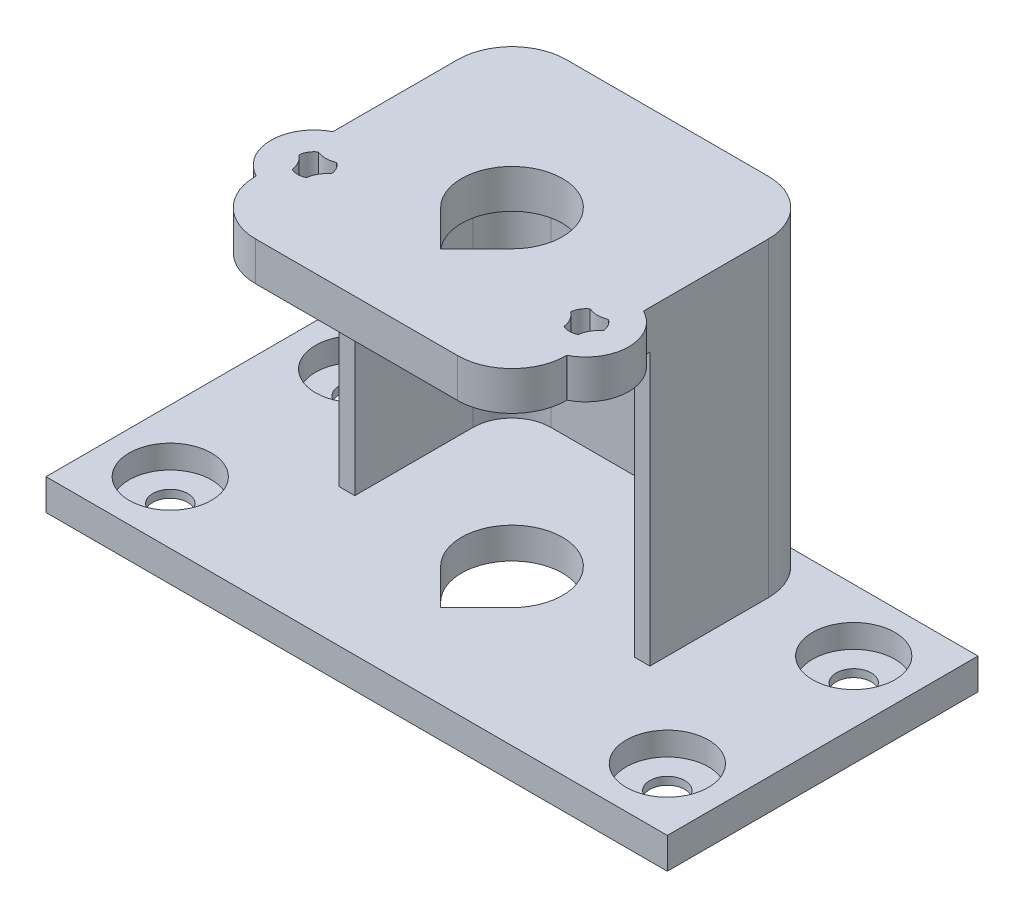
from build123d import *

# Parameters (mm, degrees)
BOSS_EXTRU_1_DEPTH                                 = 5
ESQUISSE7_W                                        = 36
ESQUISSE7_H                                        = 2
BOSS_EXTRU_2_DEPTH                                 = 35
BOSS_EXTRU_4_DEPTH                                 = 4
ESQUISSE1_3_R                                      = 6.5
ENL_V_MAT_EXTRU_2_DEPTH                            = 63.737548565
CHAMBRAGE_POUR_VIS_T_TE_HEXAGONALE_M41_D           = 4.5
CHAMBRAGE_POUR_VIS_T_TE_HEXAGONALE_M41_DEPTH       = 4
CHAMBRAGE_POUR_VIS_T_TE_HEXAGONALE_M41_CBORE_D     = 10.59
CHAMBRAGE_POUR_VIS_T_TE_HEXAGONALE_M41_CBORE_DEPTH = 3
CHAMBRAGE_POUR_VIS_T_TE_HEXAGONALE_M41_TIP         = 1.351936393
CONG_1_R                                           = 5
CONG_2_R                                           = 7


with BuildPart() as part:
    # Esquisse1 → Boss.-Extru.1 (new body)
    with BuildSketch(Plane(origin=(0, 0, 0), x_dir=(1, 0, 0), z_dir=(0, 1, 0))):
        with BuildLine():
            Line((20, 20), (-20, 20))
            Line((-20, 20), (-20, -3.067363788))
            ThreePointArc((-20, -3.067363788), (-23.03, -8), (-20, -12.932636212))
            Line((-20, -12.932636212), (-20, -20))
            Line((-20, -20), (20, -20))
            Line((20, -20), (20, -12.932636212))
            ThreePointArc((20, -12.932636212), (23.03, -8), (20, -3.067363788))
            Line((20, -3.067363788), (20, 20))
        make_face()
        with BuildLine():
            ThreePointArc((-16.580993336, -9.888233765), (-17.5, -10.1), (-18.419006664, -9.888233765))
            ThreePointArc((-18.419006664, -9.888233765), (-18.799038106, -8.75), (-19.594761741, -7.851766235))
            ThreePointArc((-19.594761741, -7.851766235), (-19.318653348, -6.95), (-18.675755077, -6.26))
            ThreePointArc((-18.675755077, -6.26), (-17.5, -6.5), (-16.324244923, -6.26))
            ThreePointArc((-16.324244923, -6.26), (-15.681346652, -6.95), (-15.405238259, -7.851766235))
            ThreePointArc((-15.405238259, -7.851766235), (-16.200961894, -8.75), (-16.580993336, -9.888233765))
        make_face(mode=Mode.SUBTRACT)
        with BuildLine():
            Line((4.596194078, -4.596194078), (0, -9.192388155))
            Line((0, -9.192388155), (-4.596194078, -4.596194078))
            ThreePointArc((-4.596194078, -4.596194078), (0, 6.5), (4.596194078, -4.596194078))
        make_face(mode=Mode.SUBTRACT)
        with BuildLine():
            ThreePointArc((18.419006664, -9.888233765), (17.5, -10.1), (16.580993336, -9.888233765))
            ThreePointArc((16.580993336, -9.888233765), (16.200961894, -8.75), (15.405238259, -7.851766235))
            ThreePointArc((15.405238259, -7.851766235), (15.681346652, -6.95), (16.324244923, -6.26))
            ThreePointArc((16.324244923, -6.26), (17.5, -6.5), (18.675755077, -6.26))
            ThreePointArc((18.675755077, -6.26), (19.318653348, -6.95), (19.594761741, -7.851766235))
            ThreePointArc((19.594761741, -7.851766235), (18.799038106, -8.75), (18.419006664, -9.888233765))
        make_face(mode=Mode.SUBTRACT)
    extrude(amount=-BOSS_EXTRU_1_DEPTH)

    # Esquisse7 → Boss.-Extru.2 (add)
    with BuildSketch(Plane.XZ.offset(5)):
        Polygon((-20, 2.243441463), (-20, -20), (-18, -20), (-18, -18), (-18, 2.243441463), align=None)
        with Locations((0, -19)):
            Rectangle(ESQUISSE7_W, ESQUISSE7_H)
        Polygon((18, -18), (18, -20), (20, -20), (20, 2.243441463), (18, 2.243441463), align=None)
    extrude(amount=BOSS_EXTRU_2_DEPTH)

    # Esquisse9 → Boss.-Extru.4 (add)
    with BuildSketch(Plane.XZ.offset(40)):
        Polygon((-20, 2.243441463), (-20, 20), (-40, 20), (-40, -20), (-20, -20), align=None)
        Polygon((40, 20), (20, 20), (20, 2.243441463), (20, -20), (40, -20), align=None)
        Polygon((0, -18), (0, 20), (-20, 20), (-20, 2.243441463), (-18, 2.243441463), (-18, -18), align=None)
        Polygon((0, -20), (0, -18), (-18, -18), (-18, 2.243441463), (-20, 2.243441463), (-20, -20), align=None)
        Polygon((18, -18), (0, -18), (0, -20), (20, -20), (20, 2.243441463), (18, 2.243441463), align=None)
        Polygon((20, 20), (0, 20), (0, -18), (18, -18), (18, 2.243441463), (20, 2.243441463), align=None)
    extrude(amount=BOSS_EXTRU_4_DEPTH)

    # Esquisse1<3> → Enlèv. mat.-Extru.2 (cut, through all)
    with BuildSketch(Plane(origin=(0, 0, 0), x_dir=(1, 0, 0), z_dir=(0, 1, 0))):
        Circle(ESQUISSE1_3_R)
        with BuildLine():
            Line((0, -9.192388155), (4.596194078, -4.596194078))
            ThreePointArc((4.596194078, -4.596194078), (0, -6.5), (-4.596194078, -4.596194078))
            Line((-4.596194078, -4.596194078), (0, -9.192388155))
        make_face()
    extrude(amount=-ENL_V_MAT_EXTRU_2_DEPTH, mode=Mode.SUBTRACT)

    # Chambrage pour vis à tête hexagonale M41
    with Locations(Plane(origin=(0, -40, 0), x_dir=(1, 0, 0), z_dir=(0, 1, 0))):
        with Locations((-32, -12), (-32, 12), (32, 12), (32, -12)):
            CounterBoreHole(CHAMBRAGE_POUR_VIS_T_TE_HEXAGONALE_M41_D / 2, CHAMBRAGE_POUR_VIS_T_TE_HEXAGONALE_M41_CBORE_D / 2, CHAMBRAGE_POUR_VIS_T_TE_HEXAGONALE_M41_CBORE_DEPTH, depth=CHAMBRAGE_POUR_VIS_T_TE_HEXAGONALE_M41_DEPTH)
            with Locations((0, 0, -(CHAMBRAGE_POUR_VIS_T_TE_HEXAGONALE_M41_DEPTH + CHAMBRAGE_POUR_VIS_T_TE_HEXAGONALE_M41_TIP / 2))):  # 118° drill point
                Cone(0, CHAMBRAGE_POUR_VIS_T_TE_HEXAGONALE_M41_D / 2, CHAMBRAGE_POUR_VIS_T_TE_HEXAGONALE_M41_TIP, mode=Mode.SUBTRACT)

    # Congé1
    cong_1_edges = [part.edges().sort_by_distance(p)[0] for p in [
        (18, -22.5, -18),
        (-18, -22.5, -18),
    ]]
    fillet(cong_1_edges, radius=CONG_1_R)

    # Congé2
    cong_2_edges = [part.edges().sort_by_distance(p)[0] for p in [
        (-20, -20, -20),
        (20, -20, -20),
        (20, -2.5, 20),
        (-20, -2.5, 20),
    ]]
    fillet(cong_2_edges, radius=CONG_2_R)


solid = part.part
